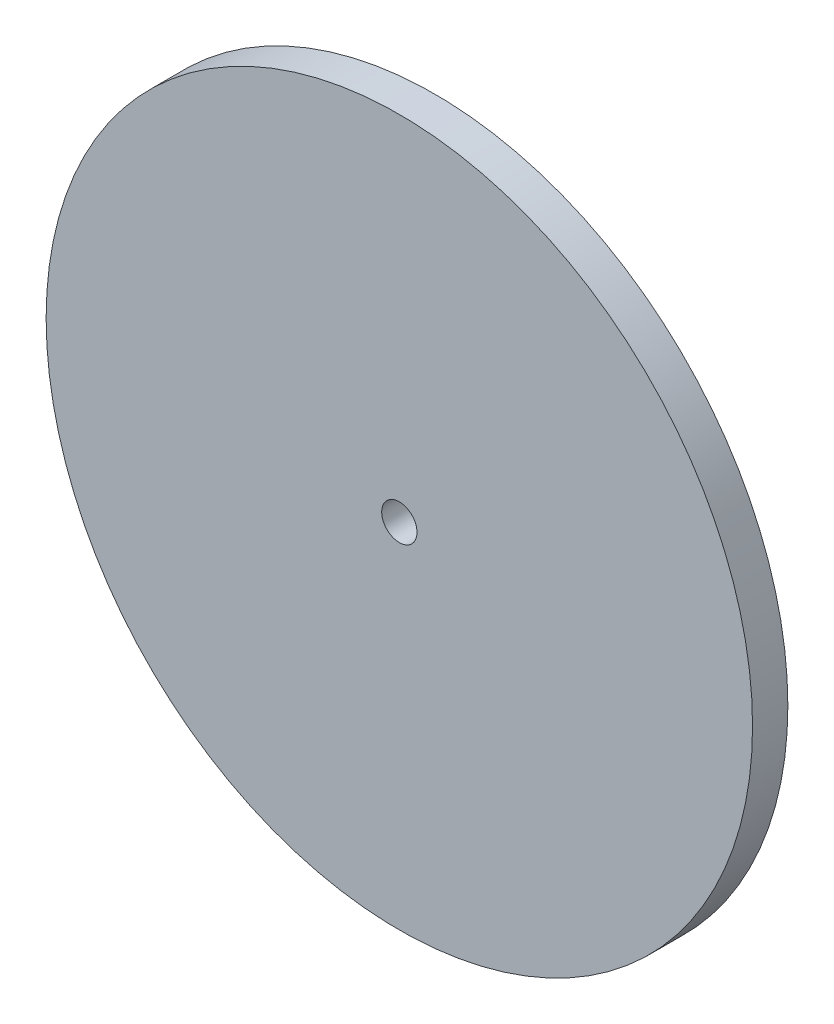
from build123d import *

# Parameters (mm, degrees)
SKETCH1_R           = 63.5
SKETCH1_R_2         = 3.175
BOSS_EXTRUDE1_DEPTH = 6.35


with BuildPart() as part:
    # Sketch1 → Boss-Extrude1 (new body)
    with BuildSketch(Plane.XY):
        Circle(SKETCH1_R)
        Circle(SKETCH1_R_2, mode=Mode.SUBTRACT)
    extrude(amount=BOSS_EXTRUDE1_DEPTH)


solid = part.part
